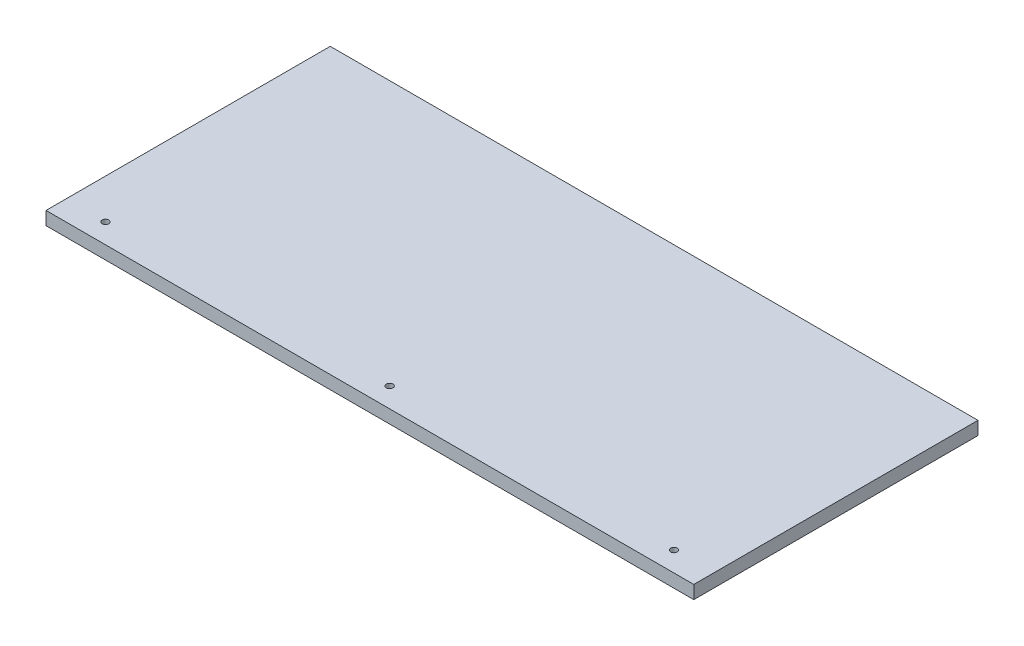
from build123d import *

# Parameters (mm, degrees)
ESBO_O1_W                = 490
ESBO_O1_H                = 215
RESSALTO_EXTRUS_O1_DEPTH = 10
ESBO_O2_R                = 2.5
CORTE_EXTRUS_O1_DEPTH    = 10


with BuildPart() as part:
    # Esboço1 → Ressalto-extrusão1 (new body)
    with BuildSketch(Plane(origin=(0, 0, 0), x_dir=(1, 0, 0), z_dir=(0, 1, 0))):
        with Locations((245, 107.5)):
            Rectangle(ESBO_O1_W, ESBO_O1_H)
    extrude(amount=RESSALTO_EXTRUS_O1_DEPTH)

    # Esboço2 → Corte-extrusão1 (cut)
    with BuildSketch(Plane(origin=(0, 10, 0), x_dir=(1, 0, 0), z_dir=(0, 1, 0))):
        with Locations(Location((30, 15, 0), (0, 0, 270))):
            Circle(ESBO_O2_R)
        with Locations(Location((460, 15, 0), (0, 0, 270))):
            Circle(ESBO_O2_R)
        with Locations(Location((245, 15, 0), (0, 0, 270))):
            Circle(ESBO_O2_R)
    extrude(amount=-CORTE_EXTRUS_O1_DEPTH, mode=Mode.SUBTRACT)


solid = part.part
